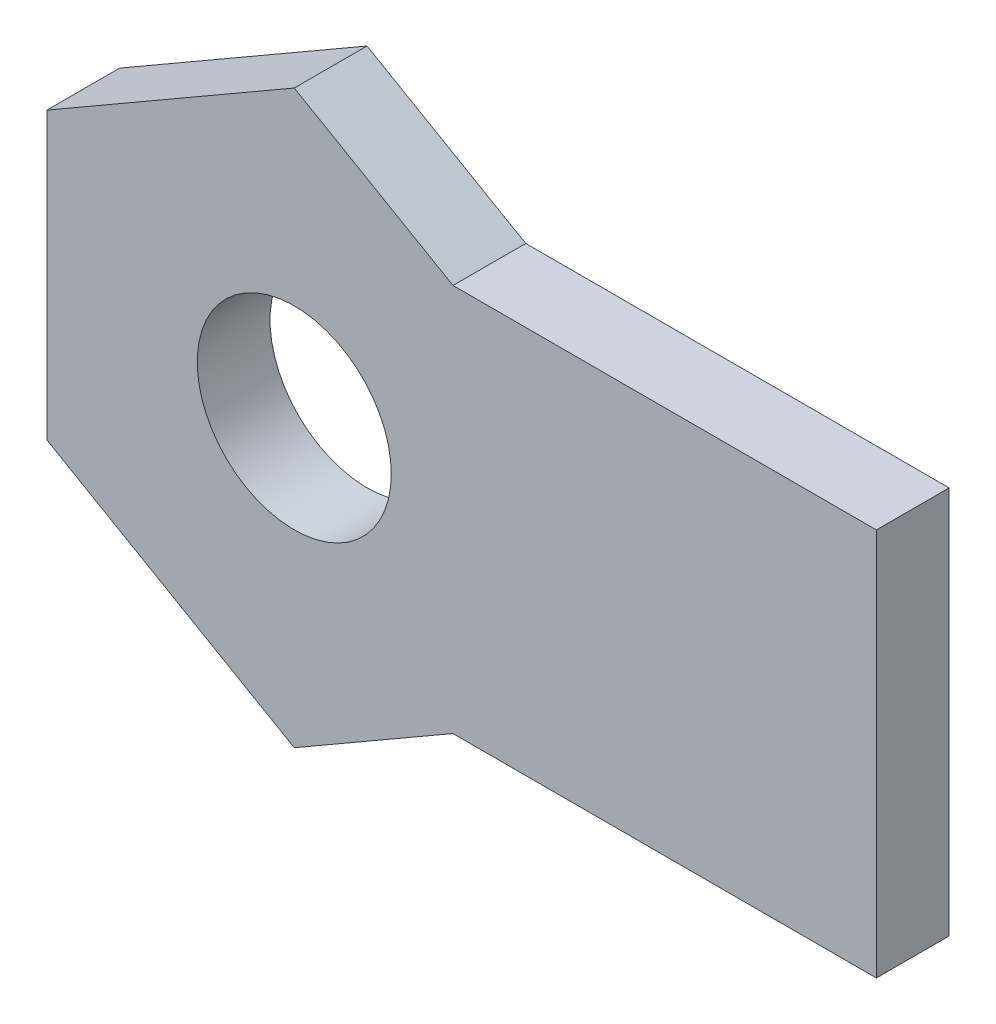
from build123d import *

# Parameters (mm, degrees)
SKETCH1_R           = 20
BOSS_EXTRUDE1_DEPTH = 15


with BuildPart() as part:
    # Sketch1 → Boss-Extrude1 (new body)
    with BuildSketch(Plane.XY):
        Polygon((32.717967697, 40), (120, 40), (120, -40), (32.717967697, -40), (0, -58.889727457), (-51, -29.444863729), (-51, 29.444863729), (0, 58.889727457), align=None)
        Circle(SKETCH1_R, mode=Mode.SUBTRACT)
    extrude(amount=BOSS_EXTRUDE1_DEPTH)


solid = part.part
